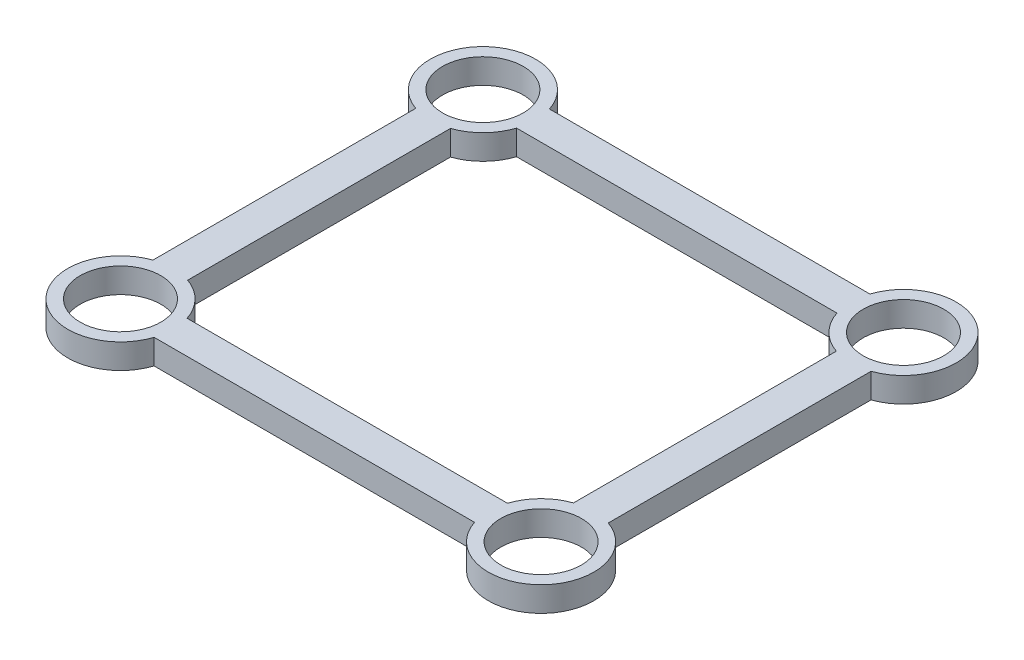
from build123d import *

# Parameters (mm, degrees)
SKETCH1_R           = 4.1275
BOSS_EXTRUDE1_DEPTH = 2.54


with BuildPart() as part:
    # Sketch1 → Boss-Extrude1 (new body)
    with BuildSketch(Plane(origin=(0, 0, 0), x_dir=(1, 0, 0), z_dir=(0, 1, 0))):
        with BuildLine():
            Line((-20.298585882, 13.192729242), (-20.298585882, -13.699245883))
            ThreePointArc((-20.298585882, -13.699245883), (-22.302045084, -22.646039068), (-13.392735754, -20.481977071))
            Line((-13.392735754, -20.481977071), (19.389056751, -20.481977071))
            ThreePointArc((19.389056751, -20.481977071), (28.298366081, -22.646039068), (26.29490688, -13.699245883))
            Line((26.29490688, -13.699245883), (26.29490688, 13.192729242))
            ThreePointArc((26.29490688, 13.192729242), (28.298366081, 22.139522426), (19.389056751, 19.975460429))
            Line((19.389056751, 19.975460429), (-13.392735754, 19.975460429))
            ThreePointArc((-13.392735754, 19.975460429), (-22.302045084, 22.139522426), (-20.298585882, 13.192729242))
        make_face()
        with Locations(Location((24.516237859, 18.288741679, 0), (0, 0, 270))):
            Circle(SKETCH1_R, mode=Mode.SUBTRACT)
        with Locations(Location((-18.519916861, -18.795258321, 0), (0, 0, 270))):
            Circle(SKETCH1_R, mode=Mode.SUBTRACT)
        with Locations(Location((-18.519916861, 18.288741679, 0), (0, 0, 270))):
            Circle(SKETCH1_R, mode=Mode.SUBTRACT)
        with Locations(Location((24.516237859, -18.795258321, 0), (0, 0, 270))):
            Circle(SKETCH1_R, mode=Mode.SUBTRACT)
        with BuildLine():
            Line((-16.74124784, 13.192729242), (-16.74124784, -13.699245883))
            ThreePointArc((-16.74124784, -13.699245883), (-14.669136115, -15.013130099), (-13.392735754, -17.108539571))
            Line((-13.392735754, -17.108539571), (19.389056751, -17.108539571))
            ThreePointArc((19.389056751, -17.108539571), (20.665457112, -15.013130099), (22.737568838, -13.699245883))
            Line((22.737568838, -13.699245883), (22.737568838, 13.192729242))
            ThreePointArc((22.737568838, 13.192729242), (20.665457112, 14.506613457), (19.389056751, 16.602022929))
            Line((19.389056751, 16.602022929), (-13.392735754, 16.602022929))
            ThreePointArc((-13.392735754, 16.602022929), (-14.669136115, 14.506613457), (-16.74124784, 13.192729242))
        make_face(mode=Mode.SUBTRACT)
    extrude(amount=BOSS_EXTRUDE1_DEPTH)


solid = part.part
